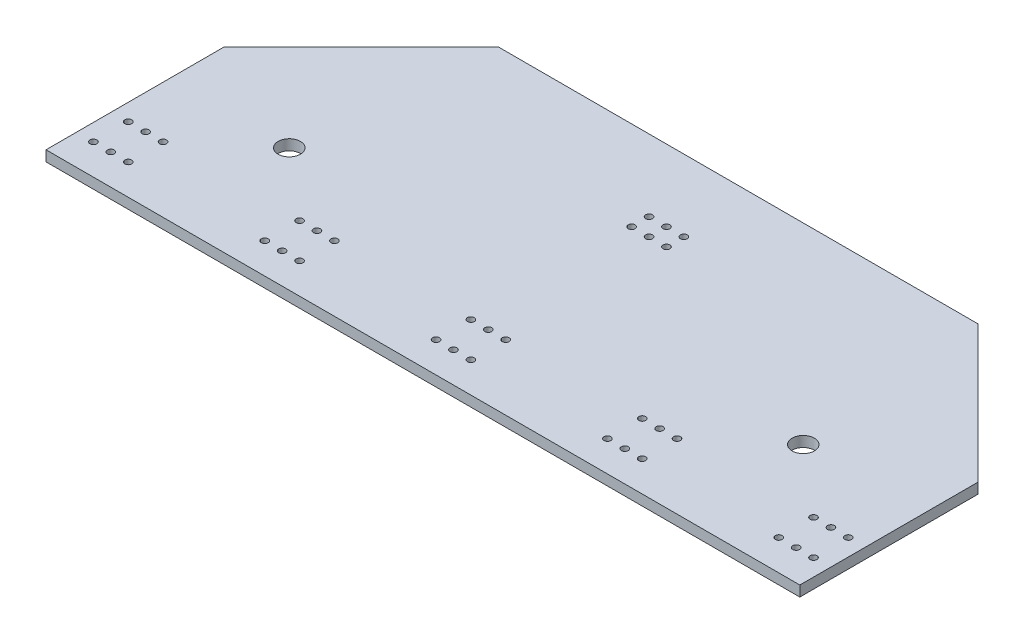
from build123d import *

# Parameters (mm, degrees)
SKETCH1_W             = 110
SKETCH1_H             = 50
BOSS_EXTRUDE1_DEPTH   = 1.53
SKETCH6_W             = 141.050966046
SKETCH6_H             = 69.53153639
SKETCH6_W_2           = 110
SKETCH6_H_2           = 50
CUT_EXTRUDE4_DEPTH    = 62.736058345
SKETCH2_R             = 0.5
PUSHBUTTONHOLES_DEPTH = 62.736058345
SKETCH7_R             = 1.625
MOUNT_HOLES_DEPTH     = 62.736058345
SKETCH5_R             = 0.5
RJ12HOLES_DEPTH       = 62.736058345
LPATTERN1_COUNT       = 3
LPATTERN1_PITCH       = 25
LPATTERN1_COL_COUNT   = 3
LPATTERN1_COL_PITCH   = 25


with BuildPart() as part:
    # Sketch1 → Boss-Extrude1 (new body)
    with BuildSketch(Plane(origin=(0, 0, 0), x_dir=(1, 0, 0), z_dir=(0, 1, 0))):
        with Locations((0, 3)):
            Rectangle(SKETCH1_W, SKETCH1_H)
    extrude(amount=BOSS_EXTRUDE1_DEPTH)

    # Sketch6 → Cut-Extrude4 (cut, through all)
    # profile 1 of 4: a face of its own
    with BuildSketch(Plane(origin=(0, 1.53, 0), x_dir=(1, 0, 0), z_dir=(0, 1, 0))):
        Rectangle(SKETCH6_W, SKETCH6_H)
        with Locations((0, 3)):
            Rectangle(SKETCH6_W_2, SKETCH6_H_2, mode=Mode.SUBTRACT)
    # profile 2 of 4: a face of its own
    with BuildSketch(Plane(origin=(0, 1.53, 0), x_dir=(1, 0, 0), z_dir=(0, 1, 0))):
        Polygon((55, -18), (-55, -18), (-55, -22), (-52, -22), (-28, -22), (55, -22), align=None)
    # profile 3 of 4: a face of its own
    with BuildSketch(Plane(origin=(0, 1.53, 0), x_dir=(1, 0, 0), z_dir=(0, 1, 0))):
        Polygon((-55, 8), (-35, 28), (-55, 28), align=None)
    # profile 4 of 4: a face of its own
    with BuildSketch(Plane(origin=(0, 1.53, 0), x_dir=(1, 0, 0), z_dir=(0, 1, 0))):
        Polygon((55, 28), (35, 28), (55, 8), align=None)
    extrude(amount=-CUT_EXTRUDE4_DEPTH, mode=Mode.SUBTRACT)

    # Sketch2 → PushButtonHoles (cut, through all)
    with BuildSketch(Plane(origin=(0, 1.53, 0), x_dir=(1, 0, 0), z_dir=(0, 1, 0))):
        with Locations(Location((-2.54, -8.46, 0), (0, 0, 270))):
            Circle(SKETCH2_R)
        with Locations(Location((0, -8.46, 0), (0, 0, 270))):
            Circle(SKETCH2_R)
        with Locations(Location((2.54, -8.46, 0), (0, 0, 270))):
            Circle(SKETCH2_R)
        with Locations(Location((-2.54, -13.54, 0), (0, 0, 270))):
            Circle(SKETCH2_R)
        with Locations(Location((0, -13.54, 0), (0, 0, 270))):
            Circle(SKETCH2_R)
        with Locations(Location((2.54, -13.54, 0), (0, 0, 270))):
            Circle(SKETCH2_R)
    pushbuttonholes = extrude(amount=-PUSHBUTTONHOLES_DEPTH, mode=Mode.SUBTRACT)

    # Sketch7 → Mount Holes (cut, through all)
    with BuildSketch(Plane(origin=(0, 1.53, 0), x_dir=(1, 0, 0), z_dir=(0, 1, 0))):
        with Locations(Location((-37.5, 0, 0), (0, 0, 270))):
            Circle(SKETCH7_R)
        with Locations(Location((37.5, 0, 0), (0, 0, 270))):
            Circle(SKETCH7_R)
    extrude(amount=-MOUNT_HOLES_DEPTH, mode=Mode.SUBTRACT)

    # Sketch5 → RJ12Holes (cut, through all)
    with BuildSketch(Plane(origin=(0, 1.53, 0), x_dir=(1, 0, 0), z_dir=(0, 1, 0))):
        with Locations(Location((-2.54, 17.54, 0), (0, 0, 270))):
            Circle(SKETCH5_R)
        with Locations(Location((0, 17.54, 0), (0, 0, 270))):
            Circle(SKETCH5_R)
        with Locations(Location((2.54, 17.54, 0), (0, 0, 270))):
            Circle(SKETCH5_R)
        with Locations(Location((-2.54, 15, 0), (0, 0, 270))):
            Circle(SKETCH5_R)
        with Locations(Location((0, 15, 0), (0, 0, 270))):
            Circle(SKETCH5_R)
        with Locations(Location((2.54, 15, 0), (0, 0, 270))):
            Circle(SKETCH5_R)
    extrude(amount=-RJ12HOLES_DEPTH, mode=Mode.SUBTRACT)

    # LPattern1: PushButtonHoles ×3
    with Locations(*[(i * LPATTERN1_PITCH, 0, 0) for i in range(1, LPATTERN1_COUNT)]):
        add(pushbuttonholes, mode=Mode.SUBTRACT)

    # LPattern1 col: PushButtonHoles ×3
    with Locations(*[(-i * LPATTERN1_COL_PITCH, 0, 0) for i in range(1, LPATTERN1_COL_COUNT)]):
        add(pushbuttonholes, mode=Mode.SUBTRACT)


solid = part.part
